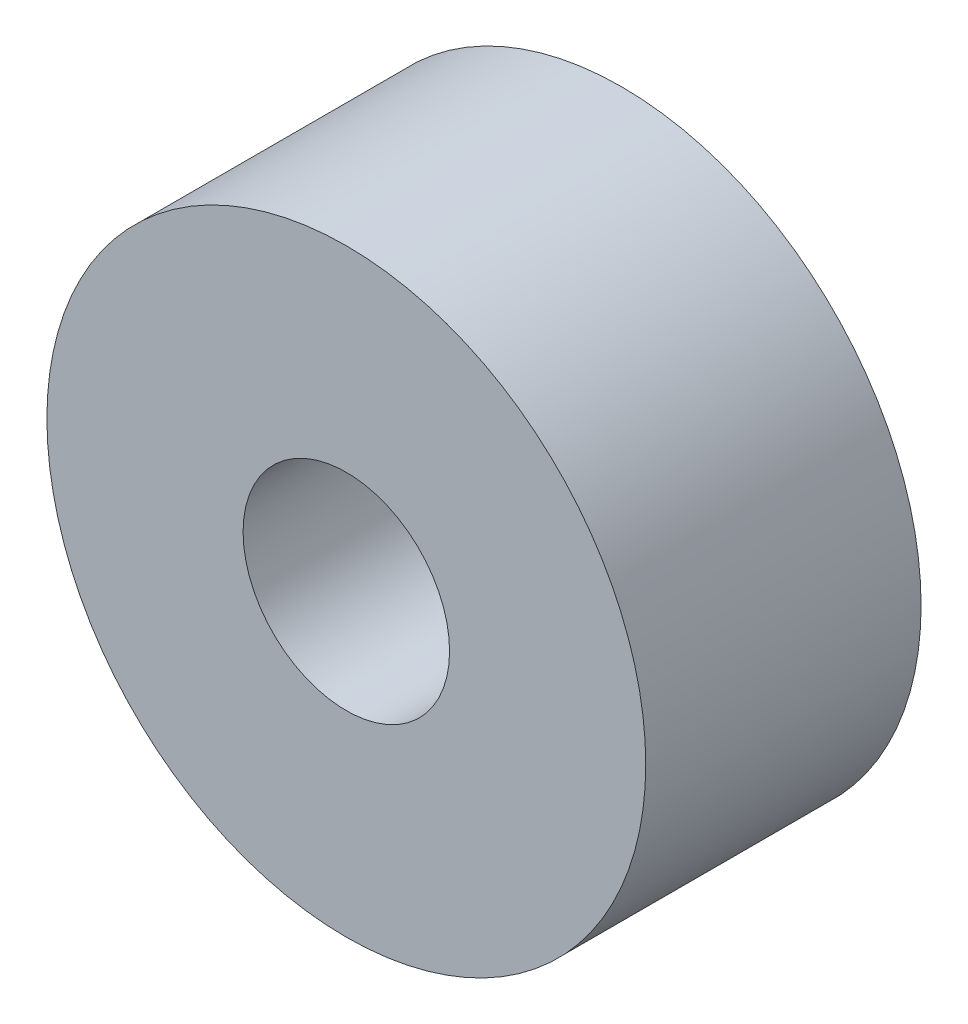
from build123d import *

# Parameters (mm, degrees)
SKETCH_1_R      = 4.35
SKETCH_1_R_2    = 1.5
EXTRUDE_1_DEPTH = 4


with BuildPart() as part:
    # 草图1 → 凸台-拉伸1 (new body)
    with BuildSketch(Plane.XY):
        Circle(SKETCH_1_R)
        Circle(SKETCH_1_R_2, mode=Mode.SUBTRACT)
    extrude(amount=EXTRUDE_1_DEPTH)


solid = part.part
